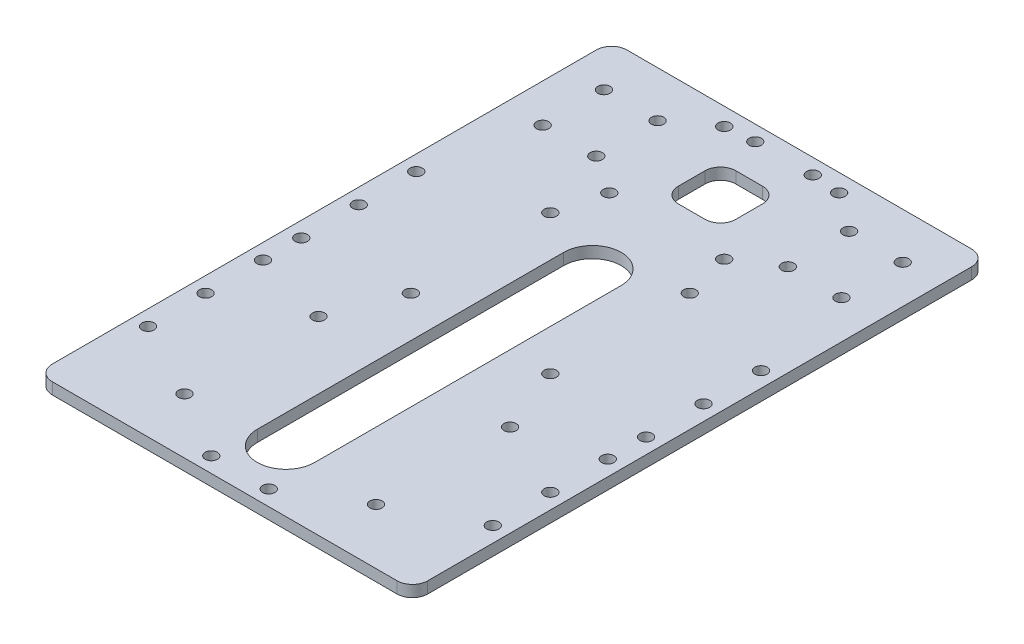
from build123d import *

# Parameters (mm, degrees)
SKETCH_3_W          = 98
SKETCH_3_H          = 150
EXTRUDE_1_DEPTH     = 3
FILLET_1_R          = 4
SKETCH_5_R          = 1.6
CUT_EXTRUDE_1_DEPTH = 3
SKETCH_6_R          = 1.6
CUT_EXTRUDE_2_DEPTH = 3
SKETCH_7_R          = 1.6
CUT_EXTRUDE_3_DEPTH = 3
SKETCH_8_R          = 1.6
CUT_EXTRUDE_4_DEPTH = 3
SKETCH_9_R          = 1.6
CUT_EXTRUDE_5_DEPTH = 10
SKETCH_10_R         = 1.6
CUT_EXTRUDE_6_DEPTH = 10
SKETCH_11_W         = 15
SKETCH_11_H         = 15
CUT_EXTRUDE_7_DEPTH = 10
FILLET_2_R          = 4


with BuildPart() as part:
    # 草图3 → 凸台-拉伸1 (new body)
    with BuildSketch(Plane(origin=(0, 0, 0), x_dir=(1, 0, 0), z_dir=(0, 1, 0))):
        Rectangle(SKETCH_3_W, SKETCH_3_H)
    extrude(amount=EXTRUDE_1_DEPTH)

    # 圆角1
    fillet_1_edges = [part.edges().sort_by_distance(p)[0] for p in [
        (49, 1.5, 75),
        (-49, 1.5, 75),
        (-49, 1.5, -75),
        (49, 1.5, -75),
    ]]
    fillet(fillet_1_edges, radius=FILLET_1_R)

    # 草图5 → 切除-拉伸1 (cut)
    with BuildSketch(Plane.XZ):
        with Locations(Location((-39, -47, 0), (0, 0, 270))):
            Circle(SKETCH_5_R)
        with Locations(Location((-25, -47, 0), (0, 0, 90))):
            Circle(SKETCH_5_R)
        with Locations(Location((-39, -63, 0), (0, 0, 90))):
            Circle(SKETCH_5_R)
        with Locations(Location((-25, -63, 0), (0, 0, 270))):
            Circle(SKETCH_5_R)
        with Locations(Location((25, -47, 0), (0, 0, 270))):
            Circle(SKETCH_5_R)
        with Locations(Location((25, -63, 0), (0, 0, 90))):
            Circle(SKETCH_5_R)
        with Locations(Location((39, -63, 0), (0, 0, 270))):
            Circle(SKETCH_5_R)
        with Locations(Location((39, -47, 0), (0, 0, 90))):
            Circle(SKETCH_5_R)
    extrude(amount=-CUT_EXTRUDE_1_DEPTH, mode=Mode.SUBTRACT)

    # 草图6 → 切除-拉伸2 (cut)
    with BuildSketch(Plane.XZ):
        with Locations(Location((-25, 60.5, 0), (0, 0, 270))):
            Circle(SKETCH_6_R)
        with Locations(Location((-25, 25.5, 0), (0, 0, 90))):
            Circle(SKETCH_6_R)
        with Locations(Location((25, 60.5, 0), (0, 0, 90))):
            Circle(SKETCH_6_R)
        with Locations(Location((25, 25.5, 0), (0, 0, 270))):
            Circle(SKETCH_6_R)
    extrude(amount=-CUT_EXTRUDE_2_DEPTH, mode=Mode.SUBTRACT)

    # 草图7 → 切除-拉伸3 (cut)
    with BuildSketch(Plane.XZ):
        with Locations(Location((-18.2, 8.2, 0), (0, 0, 270))):
            Circle(SKETCH_7_R)
        with Locations(Location((18.2, 8.2, 0), (0, 0, 90))):
            Circle(SKETCH_7_R)
        with Locations(Location((18.2, -28.2, 0), (0, 0, 270))):
            Circle(SKETCH_7_R)
        with Locations(Location((-18.2, -28.2, 0), (0, 0, 90))):
            Circle(SKETCH_7_R)
    extrude(amount=-CUT_EXTRUDE_3_DEPTH, mode=Mode.SUBTRACT)

    # 草图8 → 切除-拉伸4 (cut)
    with BuildSketch(Plane.XZ):
        with Locations(Location((45, 50, 0), (0, 0, 270))):
            Circle(SKETCH_8_R)
        with Locations(Location((-45, 50, 0), (0, 0, 90))):
            Circle(SKETCH_8_R)
        with Locations(Location((45, -20, 0), (0, 0, 90))):
            Circle(SKETCH_8_R)
        with Locations(Location((-45, -20, 0), (0, 0, 270))):
            Circle(SKETCH_8_R)
    extrude(amount=-CUT_EXTRUDE_4_DEPTH, mode=Mode.SUBTRACT)

    # 草图9 → 切除-拉伸5 (cut)
    with BuildSketch(Plane.XZ):
        with Locations(Location((-45, 35, 0), (0, 0, 270))):
            Circle(SKETCH_9_R)
        with Locations(Location((-45, 20, 0), (0, 0, 270))):
            Circle(SKETCH_9_R)
        with Locations(Location((45, 20, 0), (0, 0, 270))):
            Circle(SKETCH_9_R)
        with Locations(Location((45, 35, 0), (0, 0, 270))):
            Circle(SKETCH_9_R)
        with Locations(Location((-45, 10, 0), (0, 0, 270))):
            Circle(SKETCH_9_R)
        with Locations(Location((-45, -5, 0), (0, 0, 270))):
            Circle(SKETCH_9_R)
        with Locations(Location((45, 10, 0), (0, 0, 270))):
            Circle(SKETCH_9_R)
        with Locations(Location((45, -5, 0), (0, 0, 270))):
            Circle(SKETCH_9_R)
        with Locations(Location((-7.5, 71, 0), (0, 0, 270))):
            Circle(SKETCH_9_R)
        with Locations(Location((7.5, 71, 0), (0, 0, 270))):
            Circle(SKETCH_9_R)
        with Locations(Location((7.5, -71, 0), (0, 0, 270))):
            Circle(SKETCH_9_R)
        with Locations(Location((-7.5, -71, 0), (0, 0, 270))):
            Circle(SKETCH_9_R)
    extrude(amount=-CUT_EXTRUDE_5_DEPTH, mode=Mode.SUBTRACT)

    # 草图10 → 切除-拉伸6 (cut)
    with BuildSketch(Plane(origin=(0, 3, 0), x_dir=(1, 0, 0), z_dir=(0, 1, 0))):
        with Locations(Location((-15, 70.394924421, 0), (0, 0, 270))):
            Circle(SKETCH_10_R)
        with Locations(Location((15, 70.394924421, 0), (0, 0, 90))):
            Circle(SKETCH_10_R)
        with Locations(Location((-15, 40.394924421, 0), (0, 0, 90))):
            Circle(SKETCH_10_R)
        with Locations(Location((15, 40.394924421, 0), (0, 0, 270))):
            Circle(SKETCH_10_R)
    extrude(amount=-CUT_EXTRUDE_6_DEPTH, mode=Mode.SUBTRACT)

    # 草图11 → 切除-拉伸7 (cut)
    with BuildSketch(Plane(origin=(0, 3, 0), x_dir=(1, 0, 0), z_dir=(0, 1, 0))):
        with BuildLine():
            Line((-7.5, -59), (-7.5, 21))
            ThreePointArc((-7.5, 21), (0, 28.5), (7.5, 21))
            Line((7.5, 21), (7.5, -59))
            ThreePointArc((7.5, -59), (0, -66.5), (-7.5, -59))
        make_face()
        with Locations((0, 54.410429289)):
            Rectangle(SKETCH_11_W, SKETCH_11_H)
    extrude(amount=-CUT_EXTRUDE_7_DEPTH, mode=Mode.SUBTRACT)

    # 圆角2
    fillet_2_edges = [part.edges().sort_by_distance(p)[0] for p in [
        (7.5, 1.5, -61.910429289),
        (7.5, 1.5, -46.910429289),
        (-7.5, 1.5, -46.910429289),
        (-7.5, 1.5, -61.910429289),
    ]]
    fillet(fillet_2_edges, radius=FILLET_2_R)


solid = part.part
